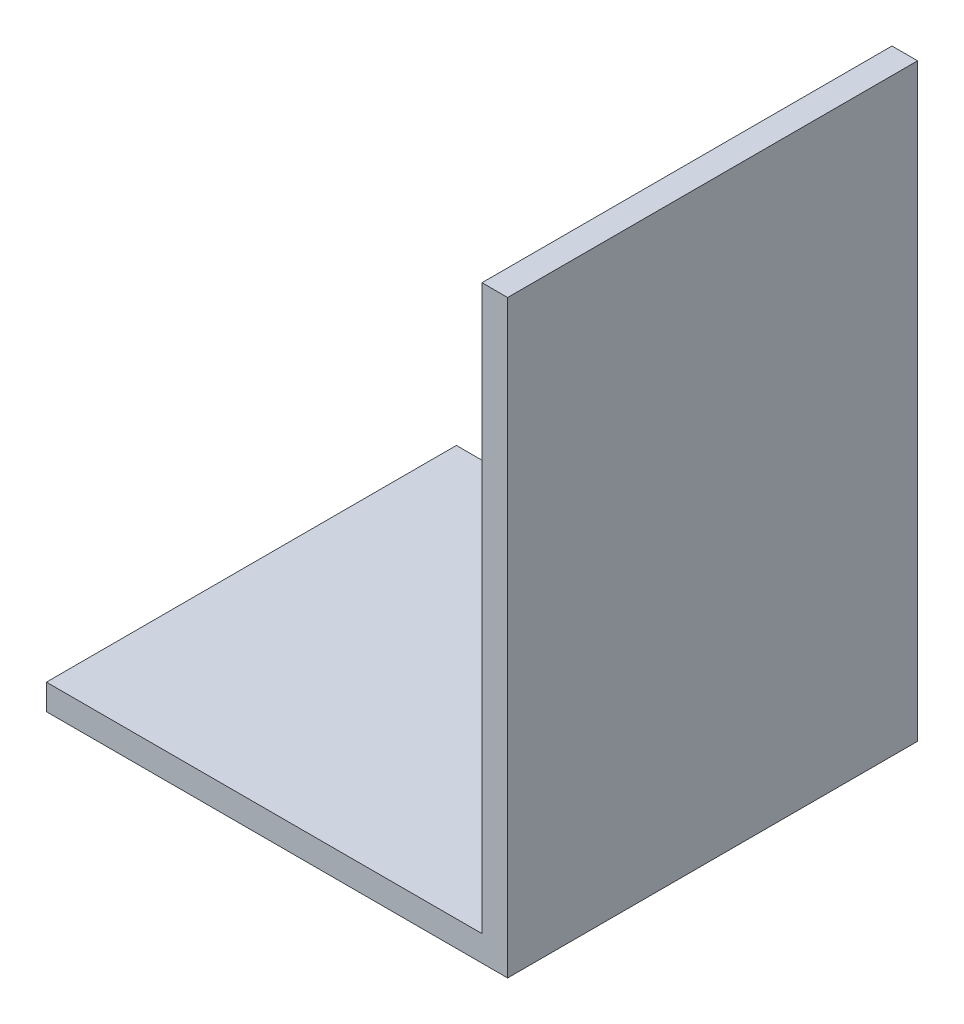
from build123d import *

# Parameters (mm, degrees)
L_ANGLE_LOAD_PATH_DEPTH = 16


with BuildPart() as part:
    # L angle load path profile → L angle load path (new body)
    with BuildSketch(Plane.XY):
        Polygon((126, 7), (144, 7), (144, 30), (143, 30), (143, 8), (126, 8), align=None)
    extrude(amount=L_ANGLE_LOAD_PATH_DEPTH)


solid = part.part
